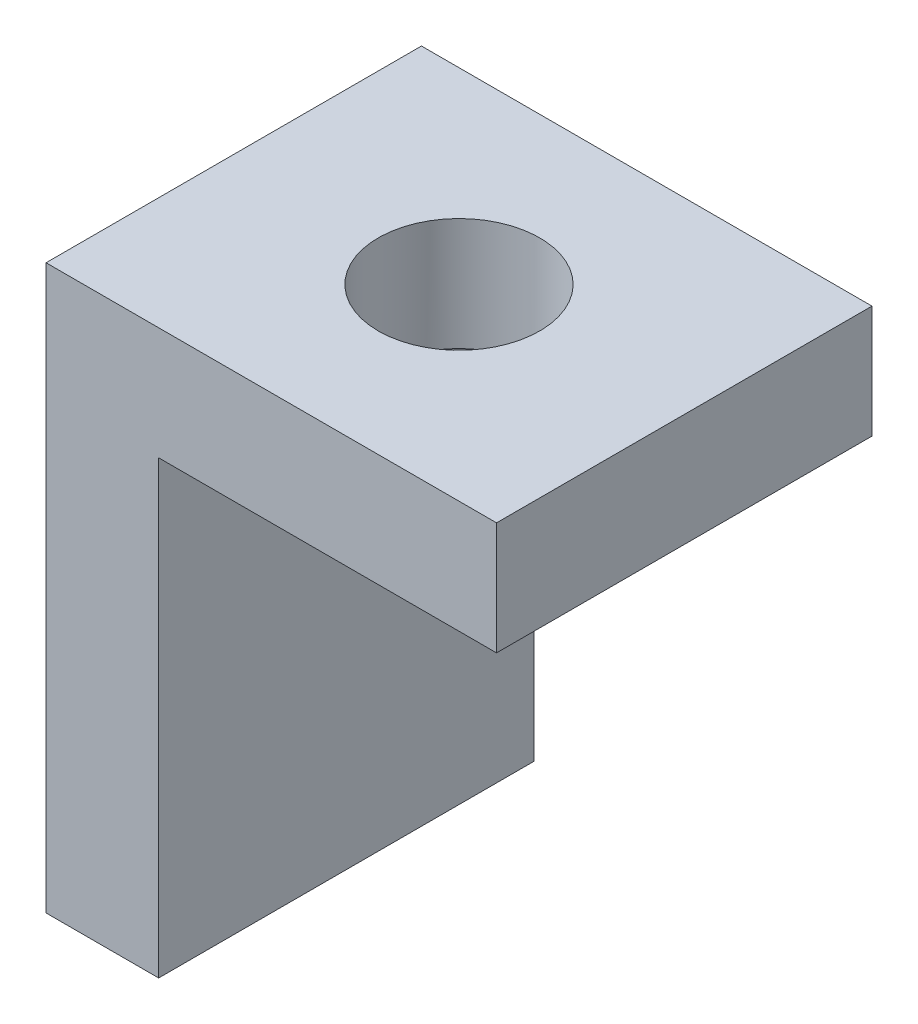
from build123d import *

# Parameters (mm, degrees)
BOSS_EXTRU_1_DEPTH = 10
D_GAGEMENT_M41_D   = 4.3


with BuildPart() as part:
    # Esquisse1 → Boss.-Extru.1 (new body)
    with BuildSketch(Plane.XY):
        Polygon((-9, 0), (-12, 0), (-12, 15), (0, 15), (0, 12), (-9, 12), align=None)
    extrude(amount=BOSS_EXTRU_1_DEPTH)

    # Dégagement M41 (through all)
    with Locations(Plane(origin=(0, 15, 0), x_dir=(1, 0, 0), z_dir=(0, 1, 0))):
        with Locations((-6, -5)):
            Hole(D_GAGEMENT_M41_D / 2)


solid = part.part
